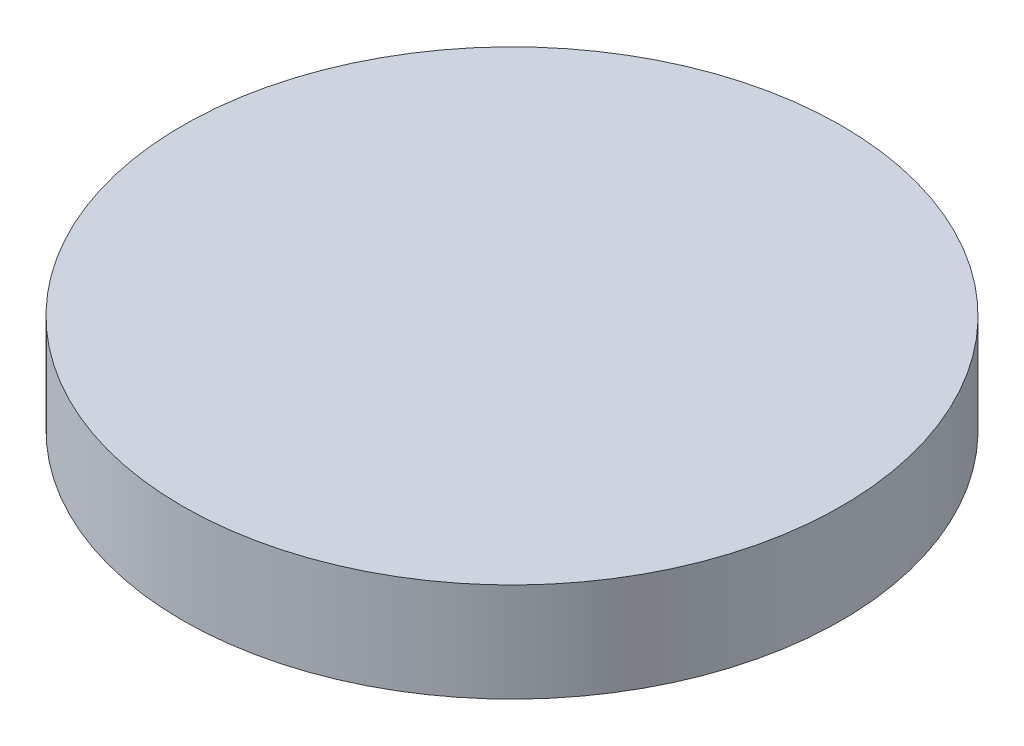
from build123d import *

# Parameters (mm, degrees)
SKETCH1_R           = 60
BOSS_EXTRUDE1_DEPTH = 18


with BuildPart() as part:
    # Sketch1 → Boss-Extrude1 (new body)
    with BuildSketch(Plane(origin=(0, 0, 0), x_dir=(1, 0, 0), z_dir=(0, 1, 0))):
        with Locations(Location((0, 0, 0), (0, 0, 270))):
            Circle(SKETCH1_R)
    extrude(amount=BOSS_EXTRUDE1_DEPTH)


solid = part.part
